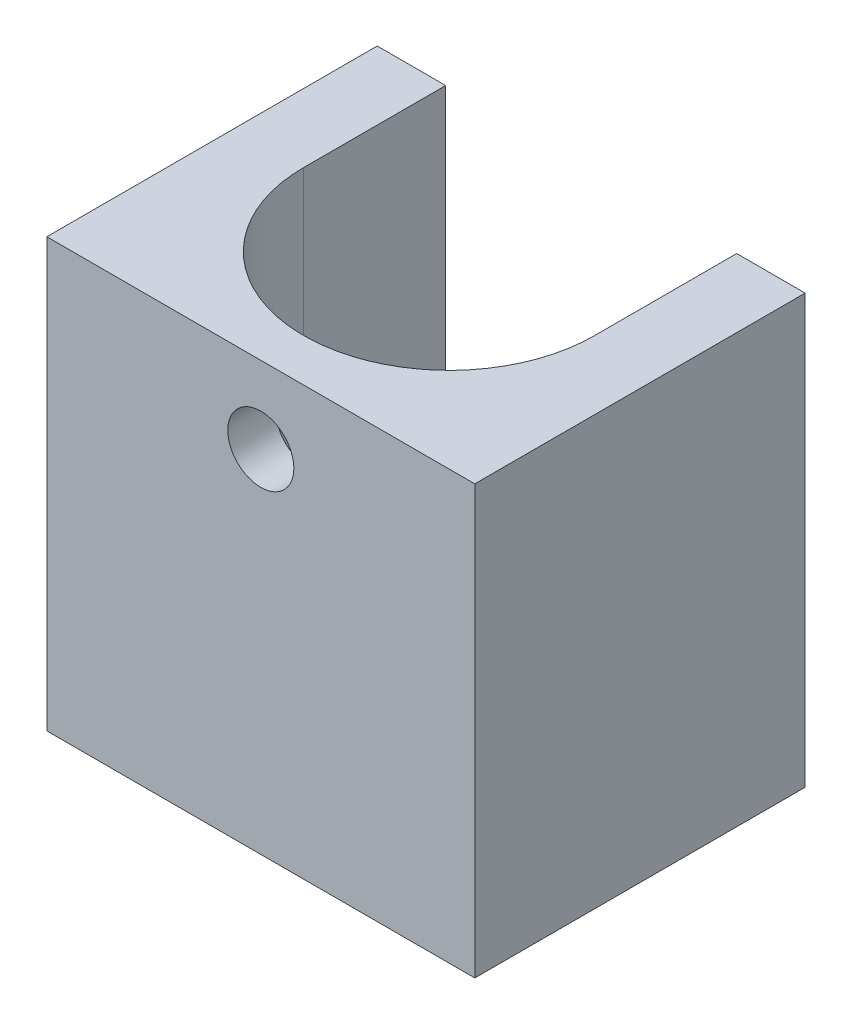
from build123d import *

# Parameters (mm, degrees)
SKETCH1_W           = 31.75
SKETCH1_H           = 3.175
BOSS_EXTRUDE1_DEPTH = 31.75
BOSS_EXTRUDE2_DEPTH = 31.75
SKETCH3_W           = 5.08
SKETCH3_H           = 10.541
BOSS_EXTRUDE3_DEPTH = 31.75
SKETCH4_R           = 2.4511
SKETCH4_R_2         = 2.3241
CUT_EXTRUDE1_DEPTH  = 31.75
SKETCH6_R           = 2.3241
BOSS_EXTRUDE4_DEPTH = 15.875
FILLET1_R           = 0.762


with BuildPart() as part:
    # Sketch1 → Boss-Extrude1 (new body)
    with BuildSketch(Plane(origin=(0, 0, 0), x_dir=(1, 0, 0), z_dir=(0, 1, 0))):
        Rectangle(SKETCH1_W, SKETCH1_H)
    extrude(amount=BOSS_EXTRUDE1_DEPTH)

    # Sketch2 → Boss-Extrude2 (add)
    with BuildSketch(Plane(origin=(0, 31.75, 0), x_dir=(1, 0, 0), z_dir=(0, 1, 0))):
        with BuildLine():
            Line((-15.875, 1.5875), (-15.875, 12.3825))
            Line((-15.875, 12.3825), (-10.795, 12.3825))
            ThreePointArc((-10.795, 12.3825), (-7.633217703, 4.749282297), (0, 1.5875))
            Line((0, 1.5875), (-15.875, 1.5875))
        make_face()
    boss_extrude2 = extrude(amount=-BOSS_EXTRUDE2_DEPTH)

    # Mirror1: Boss-Extrude2 across plane
    add(boss_extrude2.mirror(Plane(origin=(0, 0, 0), x_dir=(0, 0, 1), z_dir=(1, 0, 0))))

    # Sketch3 → Boss-Extrude3 (add)
    with BuildSketch(Plane(origin=(0, 31.75, 0), x_dir=(1, 0, 0), z_dir=(0, 1, 0))):
        with Locations((-13.335, 17.653)):
            Rectangle(SKETCH3_W, SKETCH3_H)
    boss_extrude3 = extrude(amount=-BOSS_EXTRUDE3_DEPTH)

    # Mirror2: Boss-Extrude3 across plane
    add(boss_extrude3.mirror(Plane(origin=(0, 0, 0), x_dir=(0, 0, 1), z_dir=(1, 0, 0))))

    # Sketch4 → Cut-Extrude1 (cut)
    with BuildSketch(Plane.XY.offset(1.5875)):
        with Locations((0, 26.035)):
            Circle(SKETCH4_R)
        with Locations((0, 5.715)):
            Circle(SKETCH4_R_2)
    extrude(amount=-CUT_EXTRUDE1_DEPTH, mode=Mode.SUBTRACT)

    # Sketch6 → Boss-Extrude4 (add)
    with BuildSketch(Plane.XY.offset(1.5875)):
        with Locations((0, 5.715)):
            Circle(SKETCH6_R)
    extrude(amount=-BOSS_EXTRUDE4_DEPTH)

    # Fillet1
    fillet1_edges = [part.edges().sort_by_distance(p)[0] for p in [
        (-2.3241, 5.715, -14.2875),
    ]]
    fillet(fillet1_edges, radius=FILLET1_R)


solid = part.part
